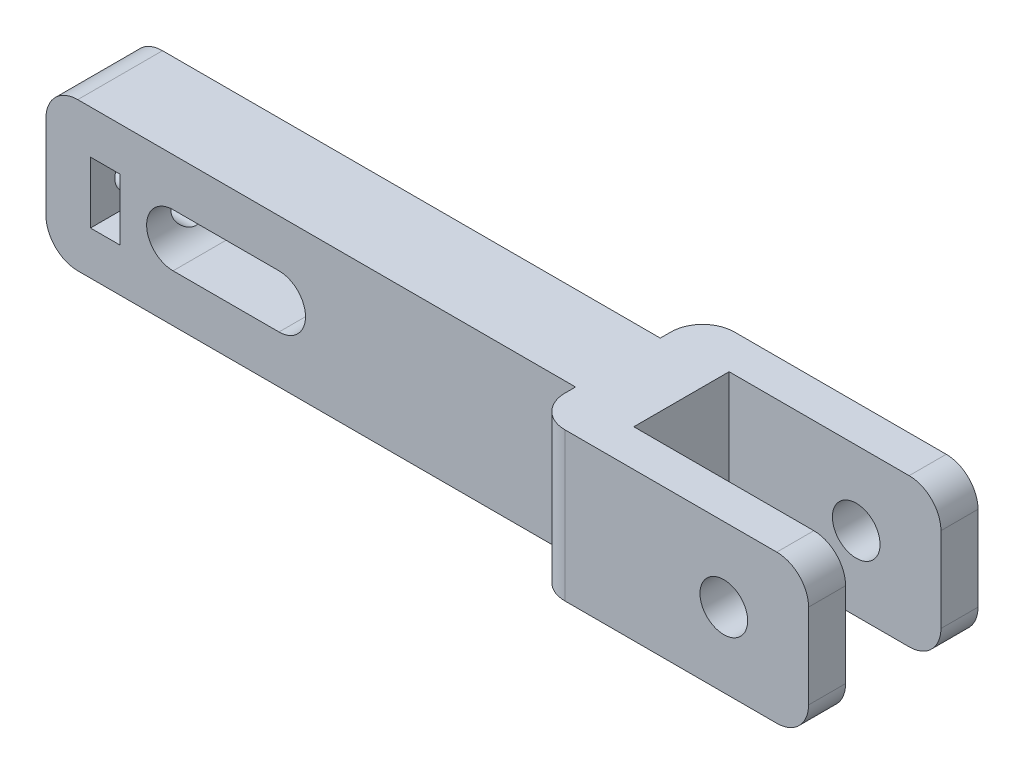
from build123d import *

# Parameters (mm, degrees)
SKETCH1_W                = 50
SKETCH1_H                = 4
BOSS_EXTRUDE1_DEPTH      = 7
M4_CLEARANCE_HOLE1_D     = 4.5
CUT_EXTRUDE1_DEPTH       = 78.259303647
CUT_EXTRUDE1_DEPTH_BACK  = 78.259303647
CUT_EXTRUDE2_DEPTH       = 2.8
M3_CLEARANCE_HOLE1_D     = 3.4
M3_CLEARANCE_HOLE1_DEPTH = 16
M3_CLEARANCE_HOLE1_TIP   = 1.021463052
FILLET1_R                = 3


with BuildPart() as part:
    # Sketch1 → Boss-Extrude1 (new, symmetric)
    with BuildSketch(Plane(origin=(0, 0, 0), x_dir=(1, 0, 0), z_dir=(0, 1, 0))):
        Polygon((50, 4), (50, 0), (56, 0), (56, 4.5), (76, 4.5), (76, 8), (50, 8), align=None)
        Polygon((50, 0), (50, -4), (50, -8), (76, -8), (76, -4.5), (56, -4.5), (56, 0), align=None)
        with Locations((25, 2)):
            Rectangle(SKETCH1_W, SKETCH1_H)
        with Locations((25, -2)):
            Rectangle(SKETCH1_W, SKETCH1_H)
    extrude(amount=BOSS_EXTRUDE1_DEPTH, both=True)

    # M4 Clearance Hole1 (through all)
    with Locations(Plane(origin=(0, 0, -8), x_dir=(-1, 0, 0), z_dir=(0, 0, -1))):
        with Locations((-68, 0)):
            Hole(M4_CLEARANCE_HOLE1_D / 2)

    # Sketch6 → Cut-Extrude1 (cut, two sides: drawn at the far end of the back side and taken through both)
    with BuildSketch(Plane(origin=(0, 0, -4), x_dir=(-1, 0, 0), z_dir=(0, 0, -1)).offset(-CUT_EXTRUDE1_DEPTH_BACK)):
        with BuildLine():
            Line((-12, -2.5), (-22, -2.5))
            ThreePointArc((-22, -2.5), (-24.5, 0), (-22, 2.5))
            Line((-22, 2.5), (-12, 2.5))
            ThreePointArc((-12, 2.5), (-9.5, 0), (-12, -2.5))
        make_face()
    extrude(amount=CUT_EXTRUDE1_DEPTH + CUT_EXTRUDE1_DEPTH_BACK, mode=Mode.SUBTRACT)

    # Sketch7 → Cut-Extrude2 (cut)
    with BuildSketch(Plane.ZY.offset(-7)):
        Polygon((4, 2.9), (-1.924315781, 2.9), (-3.598631561, 0), (-1.924315781, -2.9), (4, -2.9), align=None)
    extrude(amount=CUT_EXTRUDE2_DEPTH, mode=Mode.SUBTRACT)

    # M3 Clearance Hole1
    with Locations(Plane(origin=(0, 0, 0), x_dir=(0, 0, -1), z_dir=(-1, 0, 0))):
        with Locations((0, 0)):
            Hole(M3_CLEARANCE_HOLE1_D / 2, depth=M3_CLEARANCE_HOLE1_DEPTH)
            with Locations((0, 0, -(M3_CLEARANCE_HOLE1_DEPTH + M3_CLEARANCE_HOLE1_TIP / 2))):  # 118° drill point
                Cone(0, M3_CLEARANCE_HOLE1_D / 2, M3_CLEARANCE_HOLE1_TIP, mode=Mode.SUBTRACT)

    # Fillet1
    fillet1_edges = [part.edges().sort_by_distance(p)[0] for p in [
        (0, 7, 0),
        (76, -7, -6.25),
        (76, -7, 6.25),
        (0, -7, 0),
        (50, 0, -8),
        (50, 0, 8),
        (76, 7, 6.25),
        (76, 7, -6.25),
    ]]
    fillet(fillet1_edges, radius=FILLET1_R)


solid = part.part
